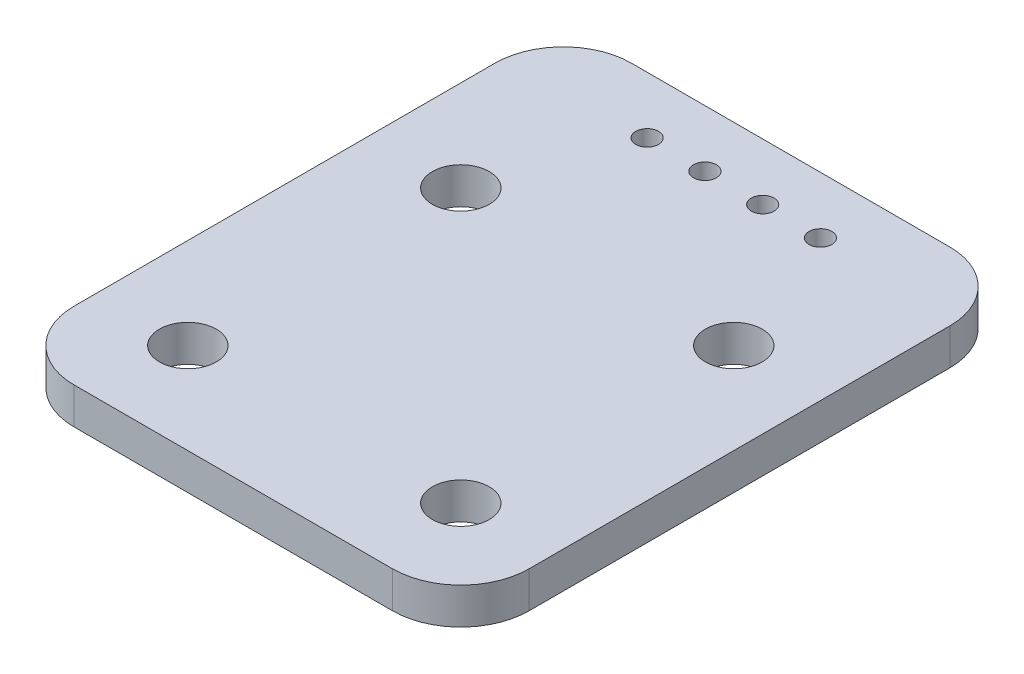
from build123d import *

# Parameters (mm, degrees)
SKETCH1_W               = 20
SKETCH1_H               = 24.5
BOSS_EXTRUDE1_DEPTH     = 1.6
CUT_EXTRUDE1_DEPTH      = 16.89410268
CUT_EXTRUDE1_DEPTH_BACK = 16.89410268
SKETCH2_R               = 1.25
SKETCH2_R_2             = 0.5
FILLET1_R               = 3


with BuildPart() as part:
    # Sketch1 → Boss-Extrude1 (new body)
    with BuildSketch(Plane(origin=(0, 0, 0), x_dir=(1, 0, 0), z_dir=(0, 1, 0))):
        Rectangle(SKETCH1_W, SKETCH1_H)
    extrude(amount=BOSS_EXTRUDE1_DEPTH)

    # Sketch2 → Cut-Extrude1 (cut, two sides: drawn at the far end of the back side and taken through both)
    with BuildSketch(Plane(origin=(0, 1.6, 0), x_dir=(1, 0, 0), z_dir=(0, 1, 0)).offset(-CUT_EXTRUDE1_DEPTH_BACK)):
        with Locations(Location((-6, -8.25, 0), (0, 0, 270))):
            Circle(SKETCH2_R)
        with Locations(Location((6, -8.25, 0), (0, 0, 270))):
            Circle(SKETCH2_R)
        with Locations(Location((6, 3.75, 0), (0, 0, 270))):
            Circle(SKETCH2_R)
        with Locations(Location((-6, 3.75, 0), (0, 0, 270))):
            Circle(SKETCH2_R)
        with Locations(Location((-3.81, 9.75, 0), (0, 0, 270))):
            Circle(SKETCH2_R_2)
        with Locations(Location((-1.27, 9.75, 0), (0, 0, 270))):
            Circle(SKETCH2_R_2)
        with Locations(Location((1.27, 9.75, 0), (0, 0, 270))):
            Circle(SKETCH2_R_2)
        with Locations(Location((3.81, 9.75, 0), (0, 0, 270))):
            Circle(SKETCH2_R_2)
    extrude(amount=CUT_EXTRUDE1_DEPTH + CUT_EXTRUDE1_DEPTH_BACK, mode=Mode.SUBTRACT)

    # Fillet1
    fillet1_edges = [part.edges().sort_by_distance(p)[0] for p in [
        (10, 0.8, 12.25),
        (-10, 0.8, 12.25),
        (-10, 0.8, -12.25),
        (10, 0.8, -12.25),
    ]]
    fillet(fillet1_edges, radius=FILLET1_R)


solid = part.part
